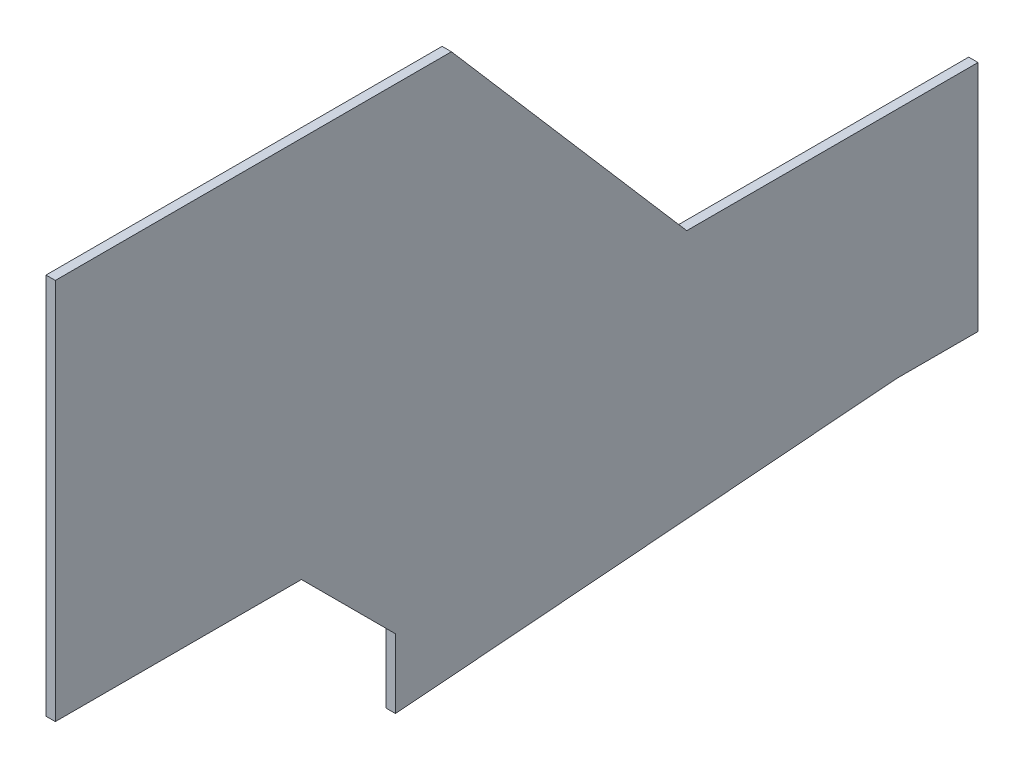
from build123d import *

# Parameters (mm, degrees)
SALIENTE_EXTRUIR1_DEPTH = 4


with BuildPart() as part:
    # Croquis2 → Saliente-Extruir1 (new body)
    with BuildSketch(Plane(origin=(0, 0, 0), x_dir=(0, 0, -1), z_dir=(1, 0, 0))):
        Polygon((-196, -75), (-90.353418897, -75), (-50, -115.353418897), (-50, -145), (165, -128), (200, -128), (200, -28), (75, -28), (-26, 89), (-196, 89), align=None)
    extrude(amount=SALIENTE_EXTRUIR1_DEPTH)


solid = part.part
